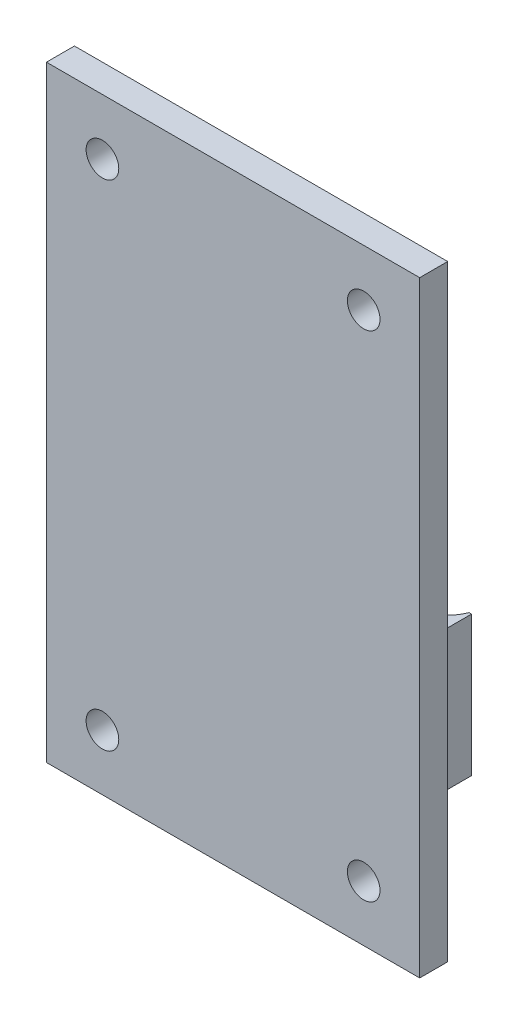
from build123d import *

# Parameters (mm, degrees)
SKETCH1_W           = 40
SKETCH1_H           = 65
SKETCH1_R           = 1.75
BOSS_EXTRUDE1_DEPTH = 3
BOSS_EXTRUDE2_DEPTH = 15


with BuildPart() as part:
    # Sketch1 → Boss-Extrude1 (new body)
    with BuildSketch(Plane.XY):
        with Locations((20, 32.5)):
            Rectangle(SKETCH1_W, SKETCH1_H)
        with Locations((6, 59)):
            Circle(SKETCH1_R, mode=Mode.SUBTRACT)
        with Locations((34, 59)):
            Circle(SKETCH1_R, mode=Mode.SUBTRACT)
        with Locations((6, 6)):
            Circle(SKETCH1_R, mode=Mode.SUBTRACT)
        with Locations((34, 6)):
            Circle(SKETCH1_R, mode=Mode.SUBTRACT)
    extrude(amount=BOSS_EXTRUDE1_DEPTH)

    # Sketch2 → Boss-Extrude2 (add)
    with BuildSketch(Plane(origin=(0, 0, 0), x_dir=(-1, 0, 0), z_dir=(0, -1, 0))):
        with BuildLine():
            Line((-24, 0), (-16, 0))
            Line((-16, 0), (-16, 18.558164094))
            Line((-16, 18.558164094), (-16.268899731, 18.558164094))
            ThreePointArc((-16.268899731, 18.558164094), (-20, 16), (-23.731100269, 18.558164094))
            Line((-23.731100269, 18.558164094), (-24, 18.558164094))
            Line((-24, 18.558164094), (-24, 0))
        make_face()
    extrude(amount=-BOSS_EXTRUDE2_DEPTH)


solid = part.part
